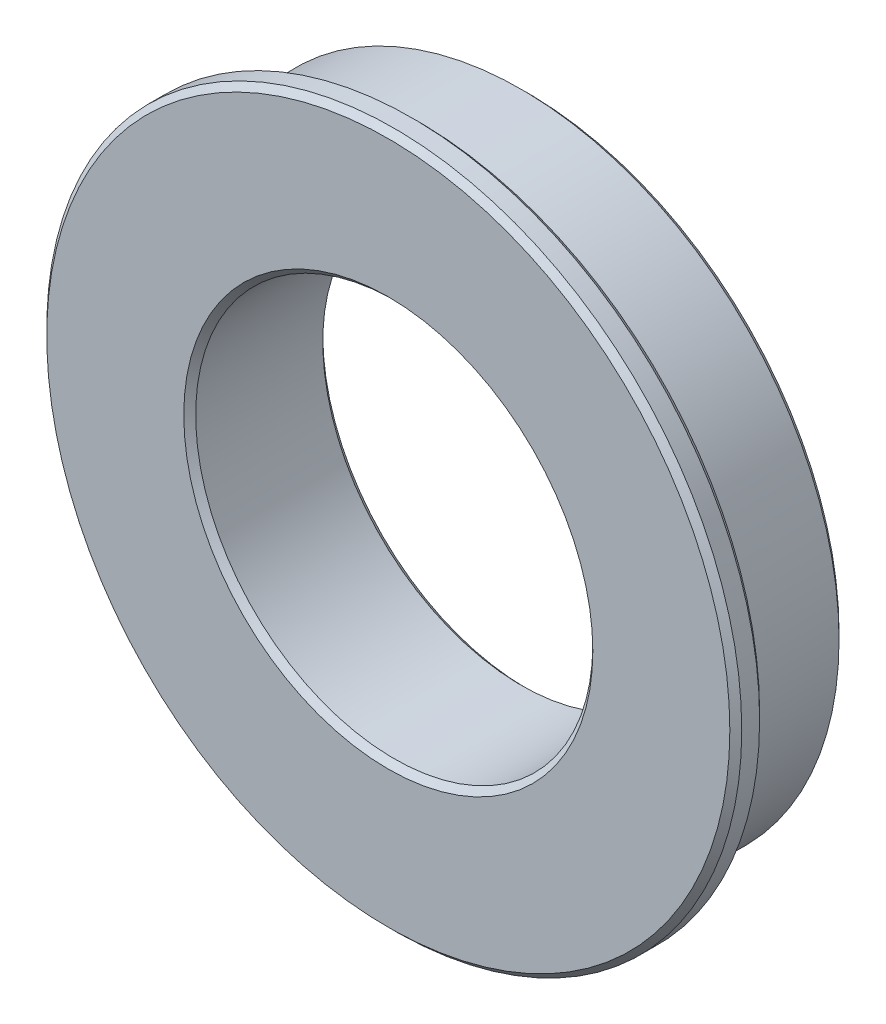
from build123d import *

# Parameters (mm, degrees)
SKETCH_1_R      = 16
SKETCH_1_R_2    = 10
EXTRUDE_1_DEPTH = 3.5
EXTRUDE_START   = -1.5
SKETCH_2_R      = 17.5
SKETCH_2_R_2    = 10
EXTRUDE_2_DEPTH = 1.5
CHAMFER_1_SIZE  = 0.3


with BuildPart() as part:
    # 草图1 → 凸台-拉伸1 (new, symmetric)
    with BuildSketch(Plane.XY):
        Circle(SKETCH_1_R)
        Circle(SKETCH_1_R_2, mode=Mode.SUBTRACT)
    extrude(amount=EXTRUDE_1_DEPTH, both=True)

    # 草图2 → 凸台-拉伸2 (add)
    with BuildSketch(Plane.XY.offset(3.5).offset(EXTRUDE_START)):
        Circle(SKETCH_2_R)
        Circle(SKETCH_2_R_2, mode=Mode.SUBTRACT)
    extrude(amount=EXTRUDE_2_DEPTH)

    # 倒角1
    chamfer_1_edges = [part.edges().sort_by_distance(p)[0] for p in [
        (-17.5, 0, 3.5),
        (-17.5, 0, 2),
        (-16, 0, -3.5),
        (-10, 0, -3.5),
        (-10, 0, 3.5),
    ]]
    chamfer(chamfer_1_edges, length=CHAMFER_1_SIZE)


solid = part.part
